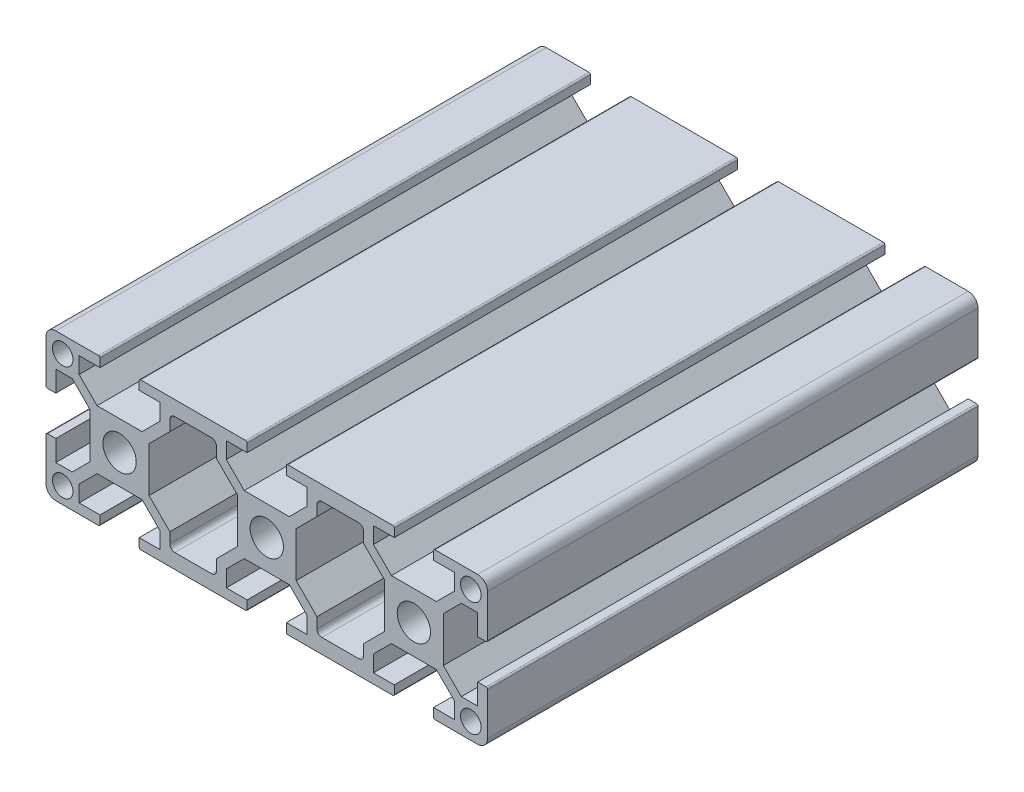
from build123d import *

# Parameters (mm, degrees)
SKETCH_1_R      = 3.4
SKETCH_1_R_2    = 2.1
EXTRUDE_1_DEPTH = 100


with BuildPart() as part:
    # 草图1 → 凸台-拉伸1 (new body)
    with BuildSketch(Plane.XY):
        with BuildLine():
            Line((-15, 13), (-15, 4.3))
            ThreePointArc((-15, 4.3), (-14.912132034, 4.087867966), (-14.7, 4))
            Line((-14.7, 4), (-13, 4))
            Line((-13, 4), (-13, 8.25))
            Line((-13, 8.25), (-9.664213562, 8.25))
            Line((-9.664213562, 8.25), (-6, 4.585786438))
            Line((-6, 4.585786438), (-6, -4.585786438))
            Line((-6, -4.585786438), (-9.664213562, -8.25))
            Line((-9.664213562, -8.25), (-13, -8.25))
            Line((-13, -8.25), (-13, -4))
            Line((-13, -4), (-14.7, -4))
            ThreePointArc((-14.7, -4), (-14.912132034, -4.087867966), (-15, -4.3))
            Line((-15, -4.3), (-15, -13))
            ThreePointArc((-15, -13), (-14.414213562, -14.414213562), (-13, -15))
            Line((-13, -15), (-4.3, -15))
            ThreePointArc((-4.3, -15), (-4.087867966, -14.912132034), (-4, -14.7))
            Line((-4, -14.7), (-4, -13))
            Line((-4, -13), (-8.25, -13))
            Line((-8.25, -13), (-8.25, -9.664213562))
            Line((-8.25, -9.664213562), (-4.585786438, -6))
            Line((-4.585786438, -6), (4.585786438, -6))
            Line((4.585786438, -6), (8.25, -9.664213562))
            Line((8.25, -9.664213562), (8.25, -13))
            Line((8.25, -13), (4, -13))
            Line((4, -13), (4, -14.7))
            ThreePointArc((4, -14.7), (4.087867966, -14.912132034), (4.3, -15))
            Line((4.3, -15), (25.7, -15))
            ThreePointArc((25.7, -15), (25.912132034, -14.912132034), (26, -14.7))
            Line((26, -14.7), (26, -13))
            Line((26, -13), (21.75, -13))
            Line((21.75, -13), (21.75, -9.664213562))
            Line((21.75, -9.664213562), (25.414213562, -6))
            Line((25.414213562, -6), (34.585786438, -6))
            Line((34.585786438, -6), (38.25, -9.664213562))
            Line((38.25, -9.664213562), (38.25, -13))
            Line((38.25, -13), (34, -13))
            Line((34, -13), (34, -14.7))
            ThreePointArc((34, -14.7), (34.087867966, -14.912132034), (34.3, -15))
            Line((34.3, -15), (55.7, -15))
            ThreePointArc((55.7, -15), (55.912132034, -14.912132034), (56, -14.7))
            Line((56, -14.7), (56, -13))
            Line((56, -13), (51.75, -13))
            Line((51.75, -13), (51.75, -9.664213562))
            Line((51.75, -9.664213562), (55.414213562, -6))
            Line((55.414213562, -6), (64.585786438, -6))
            Line((64.585786438, -6), (68.25, -9.664213562))
            Line((68.25, -9.664213562), (68.25, -13))
            Line((68.25, -13), (64, -13))
            Line((64, -13), (64, -14.7))
            ThreePointArc((64, -14.7), (64.087867966, -14.912132034), (64.3, -15))
            Line((64.3, -15), (73, -15))
            ThreePointArc((73, -15), (74.414213562, -14.414213562), (75, -13))
            Line((75, -13), (75, -4.3))
            ThreePointArc((75, -4.3), (74.912132034, -4.087867966), (74.7, -4))
            Line((74.7, -4), (73, -4))
            Line((73, -4), (73, -8.25))
            Line((73, -8.25), (69.664213562, -8.25))
            Line((69.664213562, -8.25), (66, -4.585786438))
            Line((66, -4.585786438), (66, 4.585786438))
            Line((66, 4.585786438), (69.664213562, 8.25))
            Line((69.664213562, 8.25), (73, 8.25))
            Line((73, 8.25), (73, 4))
            Line((73, 4), (74.7, 4))
            ThreePointArc((74.7, 4), (74.912132034, 4.087867966), (75, 4.3))
            Line((75, 4.3), (75, 13))
            ThreePointArc((75, 13), (74.414213562, 14.414213562), (73, 15))
            Line((73, 15), (64.3, 15))
            ThreePointArc((64.3, 15), (64.087867966, 14.912132034), (64, 14.7))
            Line((64, 14.7), (64, 13))
            Line((64, 13), (68.25, 13))
            Line((68.25, 13), (68.25, 9.664213562))
            Line((68.25, 9.664213562), (64.585786438, 6))
            Line((64.585786438, 6), (55.414213562, 6))
            Line((55.414213562, 6), (51.75, 9.664213562))
            Line((51.75, 9.664213562), (51.75, 13))
            Line((51.75, 13), (56, 13))
            Line((56, 13), (56, 14.7))
            ThreePointArc((56, 14.7), (55.912132034, 14.912132034), (55.7, 15))
            Line((55.7, 15), (34.3, 15))
            ThreePointArc((34.3, 15), (34.087867966, 14.912132034), (34, 14.7))
            Line((34, 14.7), (34, 13))
            Line((34, 13), (38.25, 13))
            Line((38.25, 13), (38.25, 9.664213562))
            Line((38.25, 9.664213562), (34.585786438, 6))
            Line((34.585786438, 6), (25.414213562, 6))
            Line((25.414213562, 6), (21.75, 9.664213562))
            Line((21.75, 9.664213562), (21.75, 13))
            Line((21.75, 13), (26, 13))
            Line((26, 13), (26, 14.7))
            ThreePointArc((26, 14.7), (25.912132034, 14.912132034), (25.7, 15))
            Line((25.7, 15), (4.3, 15))
            ThreePointArc((4.3, 15), (4.087867966, 14.912132034), (4, 14.7))
            Line((4, 14.7), (4, 13))
            Line((4, 13), (8.25, 13))
            Line((8.25, 13), (8.25, 9.664213562))
            Line((8.25, 9.664213562), (4.585786438, 6))
            Line((4.585786438, 6), (-4.585786438, 6))
            Line((-4.585786438, 6), (-8.25, 9.664213562))
            Line((-8.25, 9.664213562), (-8.25, 13))
            Line((-8.25, 13), (-4, 13))
            Line((-4, 13), (-4, 14.7))
            ThreePointArc((-4, 14.7), (-4.087867966, 14.912132034), (-4.3, 15))
            Line((-4.3, 15), (-13, 15))
            ThreePointArc((-13, 15), (-14.414213562, 14.414213562), (-15, 13))
        make_face()
        Circle(SKETCH_1_R, mode=Mode.SUBTRACT)
        with Locations((60, 0)):
            Circle(SKETCH_1_R, mode=Mode.SUBTRACT)
        with Locations((30, 0)):
            Circle(SKETCH_1_R, mode=Mode.SUBTRACT)
        with Locations((-11.6, -11.65)):
            Circle(SKETCH_1_R_2, mode=Mode.SUBTRACT)
        with Locations((71.6, -11.65)):
            Circle(SKETCH_1_R_2, mode=Mode.SUBTRACT)
        with Locations((71.6, 11.65)):
            Circle(SKETCH_1_R_2, mode=Mode.SUBTRACT)
        with Locations((-11.6, 11.65)):
            Circle(SKETCH_1_R_2, mode=Mode.SUBTRACT)
        with BuildLine():
            Line((40.25, 11), (40.25, 10))
            Line((40.25, 10), (40.25, 8.835786438))
            Line((40.25, 8.835786438), (36, 4.585786438))
            Line((36, 4.585786438), (36, -4.585786438))
            Line((36, -4.585786438), (40.25, -8.835786438))
            Line((40.25, -8.835786438), (40.25, -10))
            Line((40.25, -10), (40.25, -11))
            ThreePointArc((40.25, -11), (40.542893219, -11.707106781), (41.25, -12))
            Line((41.25, -12), (48.75, -12))
            ThreePointArc((48.75, -12), (49.457106781, -11.707106781), (49.75, -11))
            Line((49.75, -11), (49.75, -10))
            Line((49.75, -10), (49.75, -8.835786438))
            Line((49.75, -8.835786438), (54, -4.585786438))
            Line((54, -4.585786438), (54, 4.585786438))
            Line((54, 4.585786438), (49.75, 8.835786438))
            Line((49.75, 8.835786438), (49.75, 10))
            Line((49.75, 10), (49.75, 11))
            ThreePointArc((49.75, 11), (49.457106781, 11.707106781), (48.75, 12))
            Line((48.75, 12), (41.25, 12))
            ThreePointArc((41.25, 12), (40.542893219, 11.707106781), (40.25, 11))
        make_face(mode=Mode.SUBTRACT)
        with BuildLine():
            Line((18.75, 12), (11.25, 12))
            ThreePointArc((11.25, 12), (10.542893219, 11.707106781), (10.25, 11))
            Line((10.25, 11), (10.25, 10))
            Line((10.25, 10), (10.25, 8.835786438))
            Line((10.25, 8.835786438), (6, 4.585786438))
            Line((6, 4.585786438), (6, -4.585786438))
            Line((6, -4.585786438), (10.25, -8.835786438))
            Line((10.25, -8.835786438), (10.25, -10))
            Line((10.25, -10), (10.25, -11))
            ThreePointArc((10.25, -11), (10.542893219, -11.707106781), (11.25, -12))
            Line((11.25, -12), (18.75, -12))
            ThreePointArc((18.75, -12), (19.457106781, -11.707106781), (19.75, -11))
            Line((19.75, -11), (19.75, -10))
            Line((19.75, -10), (19.75, -8.835786438))
            Line((19.75, -8.835786438), (24, -4.585786438))
            Line((24, -4.585786438), (24, 4.585786438))
            Line((24, 4.585786438), (19.75, 8.835786438))
            Line((19.75, 8.835786438), (19.75, 10))
            Line((19.75, 10), (19.75, 11))
            ThreePointArc((19.75, 11), (19.457106781, 11.707106781), (18.75, 12))
        make_face(mode=Mode.SUBTRACT)
    extrude(amount=EXTRUDE_1_DEPTH)


solid = part.part
